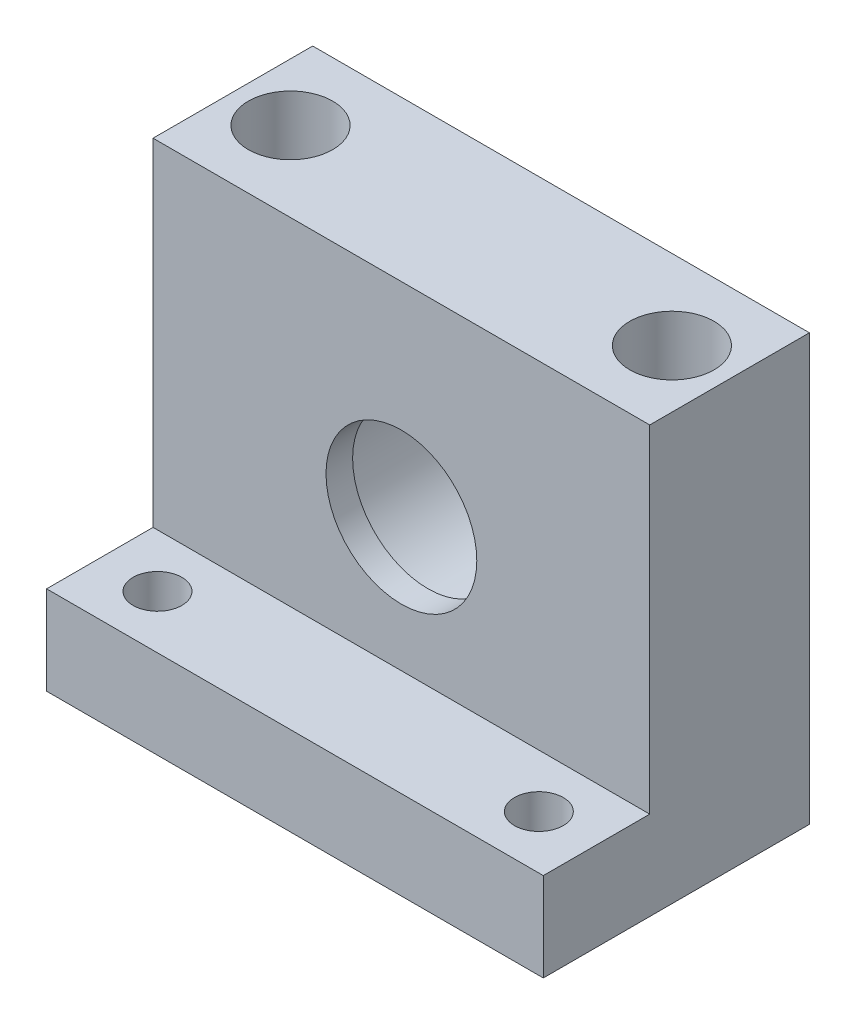
from build123d import *

# Parameters (mm, degrees)
SKETCH_1_W                   = 56
SKETCH_1_H                   = 48
EXTRUDE_1_DEPTH              = 18
SKETCH_9_R                   = 11
CUT_EXTRUDE_3_DEPTH          = 15
SKETCH_10_R                  = 8.5
CUT_EXTRUDE_4_DEPTH          = 17
HOLE_WIZARD_M3_2_D           = 2.5
HOLE_WIZARD_M3_2_DEPTH       = 8.5
HOLE_WIZARD_M3_2_TIP         = 0.751075774
HOLE_WIZARD_M5_1_D           = 5.5
HOLE_WIZARD_M5_1_CBORE_D     = 9.5
HOLE_WIZARD_M5_1_CBORE_DEPTH = 30
SKETCH_17_W                  = 56
SKETCH_17_H                  = 10
EXTRUDE_5_DEPTH              = 12
HOLE_WIZARD_5_5_5_5_1_D      = 5.5
SKETCH_21_R                  = 3
CUT_EXTRUDE_5_DEPTH          = 8


with BuildPart() as part:
    # 草图1 → 凸台-拉伸1 (new body)
    with BuildSketch(Plane.XY):
        Rectangle(SKETCH_1_W, SKETCH_1_H)
    extrude(amount=EXTRUDE_1_DEPTH)

    # 草图9 → 切除-拉伸3 (cut)
    with BuildSketch(Plane(origin=(0, 0, 0), x_dir=(-1, 0, 0), z_dir=(0, 0, -1))):
        with Locations((0, 1)):
            Circle(SKETCH_9_R)
    extrude(amount=-CUT_EXTRUDE_3_DEPTH, mode=Mode.SUBTRACT)

    # 草图10 → 切除-拉伸4 (cut)
    with BuildSketch(Plane(origin=(0, 0, 15), x_dir=(-1, 0, 0), z_dir=(0, 0, -1))):
        with Locations((0, 1)):
            Circle(SKETCH_10_R)
    extrude(amount=-CUT_EXTRUDE_4_DEPTH, mode=Mode.SUBTRACT)

    # M3 螺纹孔2
    with Locations(Plane(origin=(0, 0, 0), x_dir=(-1, 0, 0), z_dir=(0, 0, -1))):
        with Locations((12, 8), (-12, 8), (12, -6), (-12, -6)):
            Hole(HOLE_WIZARD_M3_2_D / 2, depth=HOLE_WIZARD_M3_2_DEPTH)
            with Locations((0, 0, -(HOLE_WIZARD_M3_2_DEPTH + HOLE_WIZARD_M3_2_TIP / 2))):  # 118° drill point
                Cone(0, HOLE_WIZARD_M3_2_D / 2, HOLE_WIZARD_M3_2_TIP, mode=Mode.SUBTRACT)

    # M5 六角头螺栓的柱形沉头孔1 (through all)
    with Locations(Plane(origin=(-28, 24, 18.039237195), x_dir=(1, 0, 0), z_dir=(0, 1, 0))):
        with Locations((6.5, 9.039237195), (49.5, 9.039237195)):
            CounterBoreHole(HOLE_WIZARD_M5_1_D / 2, HOLE_WIZARD_M5_1_CBORE_D / 2, HOLE_WIZARD_M5_1_CBORE_DEPTH)

    # 草图17 → 凸台-拉伸5 (add)
    with BuildSketch(Plane.XY.offset(18)):
        with Locations((0, -19)):
            Rectangle(SKETCH_17_W, SKETCH_17_H)
    extrude(amount=EXTRUDE_5_DEPTH)

    # Ø5.5 (5.5) 直径孔1 (through all)
    with Locations(Plane(origin=(0, -14, 0), x_dir=(1, 0, 0), z_dir=(0, 1, 0))):
        with Locations((-21.5, -24), (21.5, -24)):
            Hole(HOLE_WIZARD_5_5_5_5_1_D / 2)

    # 草图21 → 切除-拉伸5 (cut)
    with BuildSketch(Plane(origin=(0, 0, 0), x_dir=(-1, 0, 0), z_dir=(0, 0, -1))):
        with Locations((-12.5, 19)):
            Circle(SKETCH_21_R)
        with Locations((12.5, 19)):
            Circle(SKETCH_21_R)
    extrude(amount=-CUT_EXTRUDE_5_DEPTH, mode=Mode.SUBTRACT)


solid = part.part
